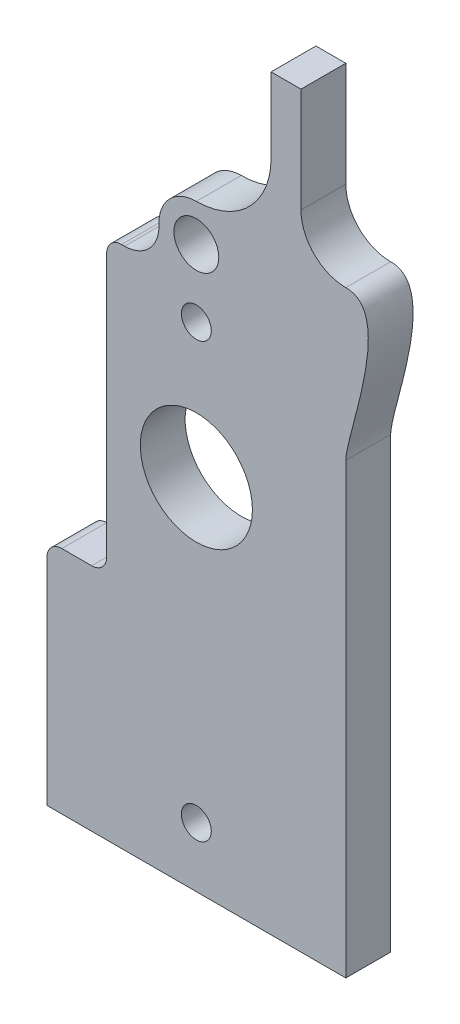
from build123d import *

# Parameters (mm, degrees)
CROQUIS2_R              = 1.5
CROQUIS2_R_2            = 1
CROQUIS2_R_3            = 3.75
SALIENTE_EXTRUIR1_DEPTH = 3


with BuildPart() as part:
    # Croquis2 → Saliente-Extruir1 (new body)
    with BuildSketch(Plane.XY):
        with BuildLine():
            Line((10, 0), (10, 30))
            add(Edge.make_bspline(
                [(10, 40), (13.382456464, 40), (10, 31.604422757), (10, 30)],
                knots=[0, 0, 0, 0, 1, 1, 1, 1], degree=3))
            ThreePointArc((10, 40), (7.878679656, 40.878679656), (7, 43))
            Line((7, 43), (7, 50))
            Line((7, 50), (5, 50))
            Line((5, 50), (5, 45))
            ThreePointArc((5, 45), (3.535533906, 41.464466094), (0, 40))
            ThreePointArc((0, 40), (-1.767766953, 39.267766953), (-2.5, 37.5))
            Line((-2.5, 37.5), (-2.5, 37.3))
            ThreePointArc((-2.5, 37.3), (-3.173654403, 35.673654403), (-4.8, 35))
            Line((-4.8, 35), (-5, 35))
            ThreePointArc((-5, 35), (-5.707106781, 34.707106781), (-6, 34))
            Line((-6, 34), (-6, 30))
            Line((-6, 30), (-6, 16.38315603))
            ThreePointArc((-6, 16.38315603), (-6.292893219, 15.676049249), (-7, 15.38315603))
            Line((-7, 15.38315603), (-9, 15.38315603))
            ThreePointArc((-9, 15.38315603), (-9.707106781, 15.090262811), (-10, 14.38315603))
            Line((-10, 14.38315603), (-10, 0))
            Line((-10, 0), (10, 0))
        make_face()
        with Locations((0, 37.5)):
            Circle(CROQUIS2_R, mode=Mode.SUBTRACT)
        with Locations((0, 33)):
            Circle(CROQUIS2_R_2, mode=Mode.SUBTRACT)
        with Locations((0, 4)):
            Circle(CROQUIS2_R_2, mode=Mode.SUBTRACT)
        with Locations((0, 24)):
            Circle(CROQUIS2_R_3, mode=Mode.SUBTRACT)
    extrude(amount=SALIENTE_EXTRUIR1_DEPTH)


solid = part.part
